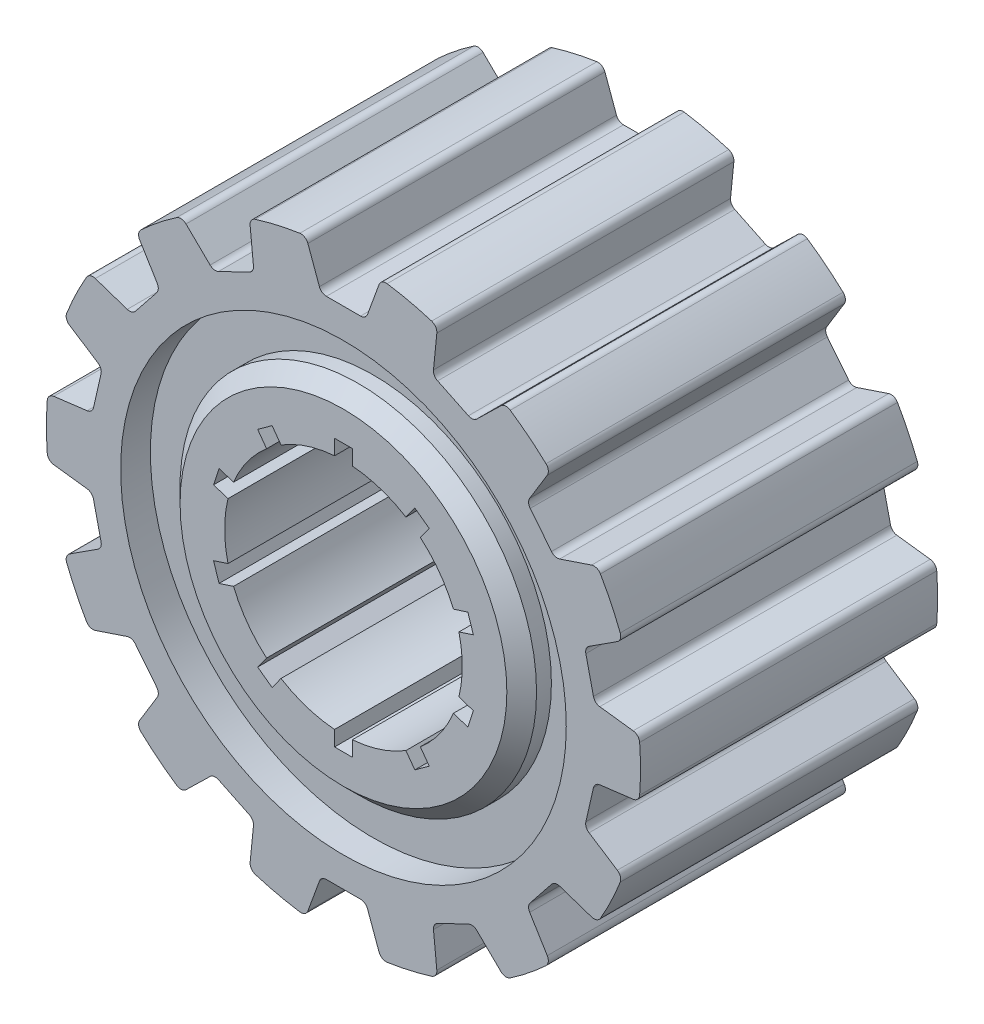
from build123d import *

# Parameters (mm, degrees)
SKETCH1_R           = 10
BOSS_EXTRUDE1_DEPTH = 10
CUT_EXTRUDE1_DEPTH  = 18.320508076
CIRPATTERN1_COUNT   = 14
SKETCH4_R           = 7.5
SKETCH4_R_2         = 6
CUT_EXTRUDE2_DEPTH  = 1
CHAMFER1_SIZE       = 0.5
CUT_EXTRUDE4_START  = -1
SKETCH6_R           = 7.5
SKETCH6_R_2         = 6
CUT_EXTRUDE4_DEPTH  = 1
CHAMFER2_SIZE       = 0.5
FILLET1_R           = 0.25


with BuildPart() as part:
    # Sketch1 → Boss-Extrude1 (new body)
    with BuildSketch(Plane.XY):
        Circle(SKETCH1_R)
        with BuildLine():
            Line((2.101814002, 3.403289277), (2.402328537, 3.81691205))
            Line((2.402328537, 3.81691205), (2.887738734, 3.464240899))
            Line((2.887738734, 3.464240899), (2.587224198, 3.050618126))
            ThreePointArc((2.587224198, 3.050618126), (3.236067977, 2.351141009), (3.700806493, 1.517903589))
            Line((3.700806493, 1.517903589), (4.187049225, 1.67589343))
            Line((4.187049225, 1.67589343), (4.372459422, 1.10525952))
            Line((4.372459422, 1.10525952), (3.886216689, 0.947269679))
            ThreePointArc((3.886216689, 0.947269679), (4, 0), (3.886216689, -0.947269679))
            Line((3.886216689, -0.947269679), (4.372459422, -1.10525952))
            Line((4.372459422, -1.10525952), (4.187049225, -1.67589343))
            Line((4.187049225, -1.67589343), (3.700806493, -1.517903589))
            ThreePointArc((3.700806493, -1.517903589), (3.236067977, -2.351141009), (2.587224198, -3.050618126))
            Line((2.587224198, -3.050618126), (2.887738734, -3.464240899))
            Line((2.887738734, -3.464240899), (2.402328537, -3.81691205))
            Line((2.402328537, -3.81691205), (2.101814002, -3.403289277))
            ThreePointArc((2.101814002, -3.403289277), (1.236067977, -3.804226065), (0.3, -3.988734135))
            Line((0.3, -3.988734135), (0.3, -4.5))
            Line((0.3, -4.5), (-0.3, -4.5))
            Line((-0.3, -4.5), (-0.3, -3.988734135))
            ThreePointArc((-0.3, -3.988734135), (-1.236067977, -3.804226065), (-2.101814002, -3.403289277))
            Line((-2.101814002, -3.403289277), (-2.402328537, -3.81691205))
            Line((-2.402328537, -3.81691205), (-2.887738734, -3.464240899))
            Line((-2.887738734, -3.464240899), (-2.587224198, -3.050618126))
            ThreePointArc((-2.587224198, -3.050618126), (-3.236067977, -2.351141009), (-3.700806493, -1.517903589))
            Line((-3.700806493, -1.517903589), (-4.187049225, -1.67589343))
            Line((-4.187049225, -1.67589343), (-4.372459422, -1.10525952))
            Line((-4.372459422, -1.10525952), (-3.886216689, -0.947269679))
            ThreePointArc((-3.886216689, -0.947269679), (-4, 0), (-3.886216689, 0.947269679))
            Line((-3.886216689, 0.947269679), (-4.372459422, 1.10525952))
            Line((-4.372459422, 1.10525952), (-4.187049225, 1.67589343))
            Line((-4.187049225, 1.67589343), (-3.700806493, 1.517903589))
            ThreePointArc((-3.700806493, 1.517903589), (-3.236067977, 2.351141009), (-2.587224198, 3.050618126))
            Line((-2.587224198, 3.050618126), (-2.887738734, 3.464240899))
            Line((-2.887738734, 3.464240899), (-2.402328537, 3.81691205))
            Line((-2.402328537, 3.81691205), (-2.101814002, 3.403289277))
            ThreePointArc((-2.101814002, 3.403289277), (-1.236067977, 3.804226065), (-0.3, 3.988734135))
            Line((-0.3, 3.988734135), (-0.3, 4.5))
            Line((-0.3, 4.5), (0.3, 4.5))
            Line((0.3, 4.5), (0.3, 3.988734135))
            ThreePointArc((0.3, 3.988734135), (1.236067977, 3.804226065), (2.101814002, 3.403289277))
        make_face(mode=Mode.SUBTRACT)
    extrude(amount=BOSS_EXTRUDE1_DEPTH)

    # Sketch2 → Cut-Extrude1 (cut, through all)
    with BuildSketch(Plane.XY.offset(10)):
        with BuildLine():
            Line((-0.75, 8.5), (0.75, 8.5))
            Line((0.75, 8.5), (1.266640021, 9.919456792))
            ThreePointArc((1.266640021, 9.919456792), (0, 10.615950068), (-1.266640021, 9.919456792))
            Line((-1.266640021, 9.919456792), (-0.75, 8.5))
        make_face()
    cut_extrude1 = extrude(amount=-CUT_EXTRUDE1_DEPTH, mode=Mode.SUBTRACT)

    # CirPattern1: Cut-Extrude1 ×14 about axis
    cirpattern1_axis = Axis((0, 0, 0), (0, 0, 1))
    for i in range(1, CIRPATTERN1_COUNT):
        add(cut_extrude1.rotate(cirpattern1_axis, i * 360 / CIRPATTERN1_COUNT), mode=Mode.SUBTRACT)

    # Sketch4 → Cut-Extrude2 (cut)
    with BuildSketch(Plane.XY.offset(10)):
        Circle(SKETCH4_R)
        Circle(SKETCH4_R_2, mode=Mode.SUBTRACT)
    extrude(amount=-CUT_EXTRUDE2_DEPTH, mode=Mode.SUBTRACT)

    # Chamfer1
    chamfer1_edges = [part.edges().sort_by_distance(p)[0] for p in [
        (-6, 0, 10),
    ]]
    chamfer(chamfer1_edges, length=CHAMFER1_SIZE)

    # Sketch6 → Cut-Extrude4 (cut)
    with BuildSketch(Plane(origin=(0, 0, 0), x_dir=(-1, 0, 0), z_dir=(0, 0, -1)).offset(CUT_EXTRUDE4_START)):
        with Locations(Location((0, 0, 0), (0, 0, 180))):
            Circle(SKETCH6_R)
        with Locations(Location((0, 0, 0), (0, 0, 180))):
            Circle(SKETCH6_R_2, mode=Mode.SUBTRACT)
    extrude(amount=CUT_EXTRUDE4_DEPTH, mode=Mode.SUBTRACT)

    # Chamfer2
    chamfer2_edges = [part.edges().sort_by_distance(p)[0] for p in [
        (-6, 0, 0),
    ]]
    chamfer(chamfer2_edges, length=CHAMFER2_SIZE)

    # Fillet1
    fillet1_edges = [part.edges().sort_by_distance(p)[0] for p in [
        (1.266640021, 9.919456792, 5),
        (0.75, 8.5, 5),
        (-0.75, 8.5, 5),
        (-1.266640021, 9.919456792, 5),
        (-8.545080745, 5.194381104, 5),
        (-6.965606473, 7.174979196, 5),
        (-6.17795025, 5.886036928, 5),
        (-7.113184952, 4.713289704, 5),
        (-9.952609221, 0.972404078, 5),
        (-9.38890138, 3.442169501, 5),
        (-8.119996553, 2.622623873, 5),
        (-8.453777954, 1.160232004, 5),
        (-9.38890138, -3.442169501, 5),
        (-9.952609221, -0.972404078, 5),
        (-8.453777954, -1.160232004, 5),
        (-8.119996553, -2.622623873, 5),
        (-6.965606473, -7.174979196, 5),
        (-8.545080745, -5.194381104, 5),
        (-7.113184952, -4.713289704, 5),
        (-6.17795025, -5.886036928, 5),
        (-3.162687777, -9.486696265, 5),
        (-5.445094229, -8.387547248, 5),
        (-4.363738433, -7.332822573, 5),
        (-3.012285132, -7.983648182, 5),
        (1.266640021, -9.919456792, 5),
        (-1.266640021, -9.919456792, 5),
        (-0.75, -8.5, 5),
        (0.75, -8.5, 5),
        (5.445094229, -8.387547248, 5),
        (3.162687777, -9.486696265, 5),
        (3.012285132, -7.983648182, 5),
        (4.363738433, -7.332822573, 5),
        (8.545080745, -5.194381104, 5),
        (6.965606473, -7.174979196, 5),
        (6.17795025, -5.886036928, 5),
        (7.113184952, -4.713289704, 5),
        (9.952609221, -0.972404078, 5),
        (9.38890138, -3.442169501, 5),
        (8.119996553, -2.622623873, 5),
        (8.453777954, -1.160232004, 5),
        (9.38890138, 3.442169501, 5),
        (9.952609221, 0.972404078, 5),
        (8.453777954, 1.160232004, 5),
        (8.119996553, 2.622623873, 5),
        (6.965606473, 7.174979196, 5),
        (8.545080745, 5.194381104, 5),
        (7.113184952, 4.713289704, 5),
        (6.17795025, 5.886036928, 5),
        (3.162687777, 9.486696265, 5),
        (5.445094229, 8.387547248, 5),
        (4.363738433, 7.332822573, 5),
        (3.012285132, 7.983648182, 5),
        (-5.445094229, 8.387547248, 5),
        (-3.162687777, 9.486696265, 5),
        (-3.012285132, 7.983648182, 5),
        (-4.363738433, 7.332822573, 5),
    ]]
    fillet(fillet1_edges, radius=FILLET1_R)


solid = part.part
